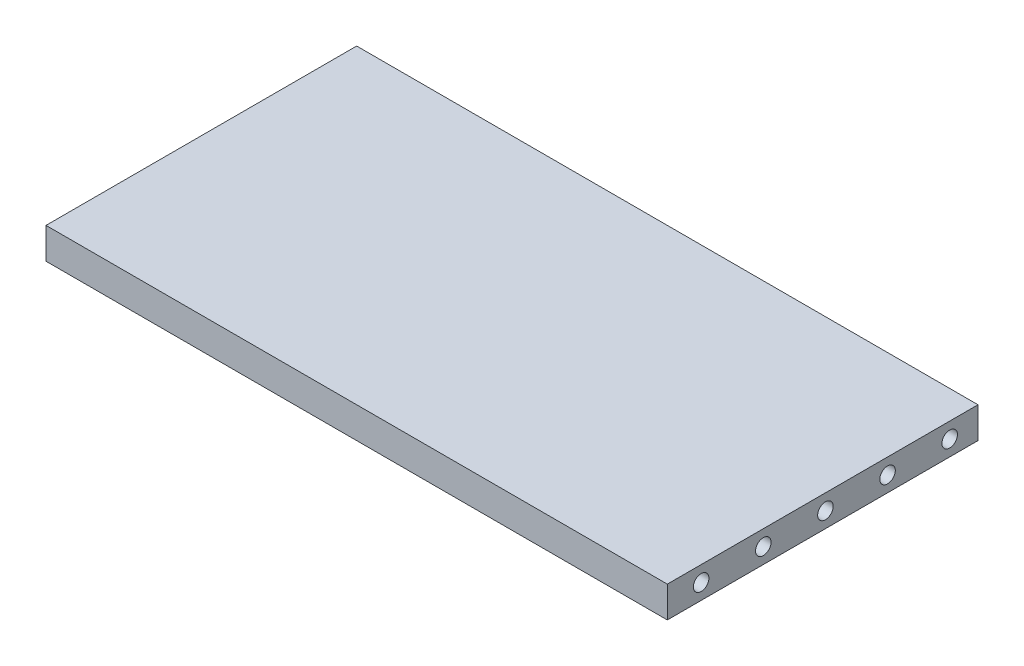
from build123d import *

# Parameters (mm, degrees)
SKETCH1_W           = 127
SKETCH1_H           = 63.5
BOSS_EXTRUDE1_DEPTH = 6.35
CUT_EXTRUDE1_REACH  = 133.063
SKETCH2_R           = 1.5875
LPATTERN1_COUNT     = 5
LPATTERN1_PITCH     = 12.7


with BuildPart() as part:
    # Sketch1 → Boss-Extrude1 (new body)
    with BuildSketch(Plane(origin=(0, 0, 0), x_dir=(1, 0, 0), z_dir=(0, 1, 0))):
        Rectangle(SKETCH1_W, SKETCH1_H)
    extrude(amount=BOSS_EXTRUDE1_DEPTH)

    # Sketch2 → Cut-Extrude1 (cut, up to next)
    with BuildSketch(Plane.ZY.offset(63.5), mode=Mode.PRIVATE) as cut_extrude1_sk1:
        with Locations((-25.962928712, 3.175)):
            Circle(SKETCH2_R)
    cut_extrude1_tool1 = extrude(cut_extrude1_sk1.sketch, amount=-CUT_EXTRUDE1_REACH, mode=Mode.PRIVATE) & part.part
    cut_extrude1 = cut_extrude1_tool1.solids().sort_by_distance((-63.5, 3.175, -25.962929))[0]
    add(cut_extrude1, mode=Mode.SUBTRACT)

    # LPattern1: Cut-Extrude1 ×5
    with Locations(*[(0, 0, i * LPATTERN1_PITCH) for i in range(1, LPATTERN1_COUNT)]):
        add(cut_extrude1, mode=Mode.SUBTRACT)


solid = part.part
